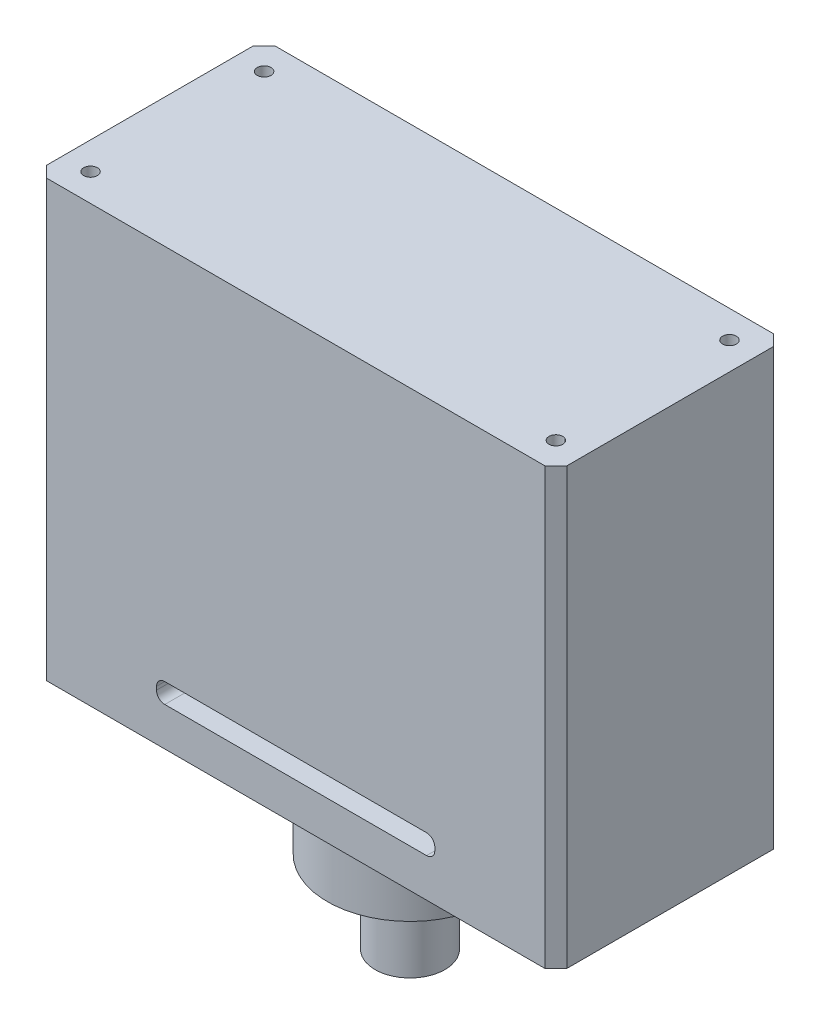
from build123d import *

# Parameters (mm, degrees)
BOSS_EXTRUDE1_DEPTH         = 79
SKETCH2_W                   = 12.7
SKETCH2_H                   = 19.05
BOSS_EXTRUDE2_DEPTH         = 2.7
LPATTERN1_COUNT             = 2
LPATTERN1_PITCH             = 70
LPATTERN1_COUNT_DIR2        = 2
LPATTERN1_PITCH_DIR2        = 52
SKETCH3_R                   = 15
BOSS_EXTRUDE3_DEPTH         = 15
SKETCH4_R                   = 6.35
BOSS_EXTRUDE4_DEPTH         = 15
CUT_EXTRUDE1_DEPTH          = 131.826000856
TAP_DRILL_FOR_M3X0_5_TAP1_D = 2.5


with BuildPart() as part:
    # Sketch1 → Boss-Extrude1 (new body)
    with BuildSketch(Plane(origin=(0, 0, 0), x_dir=(1, 0, 0), z_dir=(0, 1, 0))):
        Polygon((0, 39.5), (2, 41.5), (92.45, 41.5), (94.45, 39.5), (94.45, 2), (92.45, 0), (2, 0), (0, 2), align=None)
    extrude(amount=BOSS_EXTRUDE1_DEPTH)

    # Sketch2 → Boss-Extrude2 (add)
    with BuildSketch(Plane(origin=(0, 0, -41.5), x_dir=(-1, 0, 0), z_dir=(0, 0, -1))):
        with Locations((-12.634045562, 12.971461945)):
            Rectangle(SKETCH2_W, SKETCH2_H)
    boss_extrude2 = extrude(amount=BOSS_EXTRUDE2_DEPTH)

    # LPattern1: Boss-Extrude2 2 × 2
    with Locations(*[(i * LPATTERN1_PITCH, j * LPATTERN1_PITCH_DIR2, 0) for i in range(LPATTERN1_COUNT) for j in range(LPATTERN1_COUNT_DIR2) if (i, j) != (0, 0)]):
        add(boss_extrude2)

    # Sketch3 → Boss-Extrude3 (add)
    with BuildSketch(Plane.XZ):
        with Locations(Location((47.225, -20.75, 0), (0, 0, 270))):
            Circle(SKETCH3_R)
    extrude(amount=BOSS_EXTRUDE3_DEPTH)

    # Sketch4 → Boss-Extrude4 (add)
    with BuildSketch(Plane.XZ.offset(15)):
        with Locations(Location((47.225, -20.75, 0), (0, 0, 270))):
            Circle(SKETCH4_R)
    extrude(amount=BOSS_EXTRUDE4_DEPTH)

    # Sketch5 → Cut-Extrude1 (cut, through all)
    with BuildSketch(Plane.XY):
        with BuildLine():
            Line((70.975, 7), (23.475, 7))
            ThreePointArc((23.475, 7), (22.414339828, 7.439339828), (21.975, 8.5))
            Line((21.975, 8.5), (21.975, 9.1))
            ThreePointArc((21.975, 9.1), (22.414339828, 10.160660172), (23.475, 10.6))
            Line((23.475, 10.6), (70.975, 10.6))
            ThreePointArc((70.975, 10.6), (72.035660172, 10.160660172), (72.475, 9.1))
            Line((72.475, 9.1), (72.475, 8.5))
            ThreePointArc((72.475, 8.5), (72.035660172, 7.439339828), (70.975, 7))
        make_face()
    extrude(amount=-CUT_EXTRUDE1_DEPTH, mode=Mode.SUBTRACT)

    # Tap Drill for M3x0.5 Tap1 (through all)
    with Locations(Plane(origin=(0, 0, 0), x_dir=(-1, 0, 0), z_dir=(0, -1, 0))):
        with Locations((-5, 5), (-5, 36.5), (-89.45, 36.5), (-89.45, 5)):
            Hole(TAP_DRILL_FOR_M3X0_5_TAP1_D / 2)


solid = part.part
